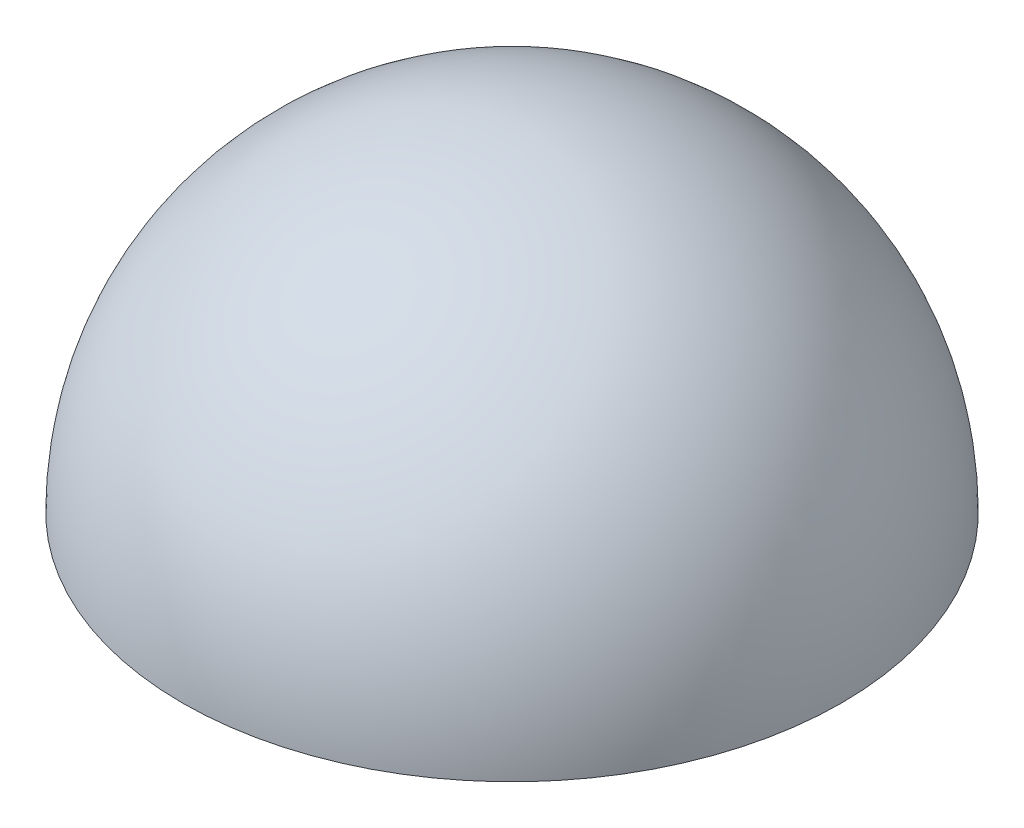
from build123d import *


with BuildPart() as part:
    # Sketch1 → Revolve1 (revolve)
    with BuildSketch(Plane.XY):
        with BuildLine():
            Line((0, 0), (0, 37.084))
            ThreePointArc((0, 37.084), (-26.222347874, 26.222347874), (-37.084, 0))
            Line((-37.084, 0), (0, 0))
        make_face()
    revolve(axis=Axis((0, 0, 0), (0, 1, 0)))


solid = part.part
